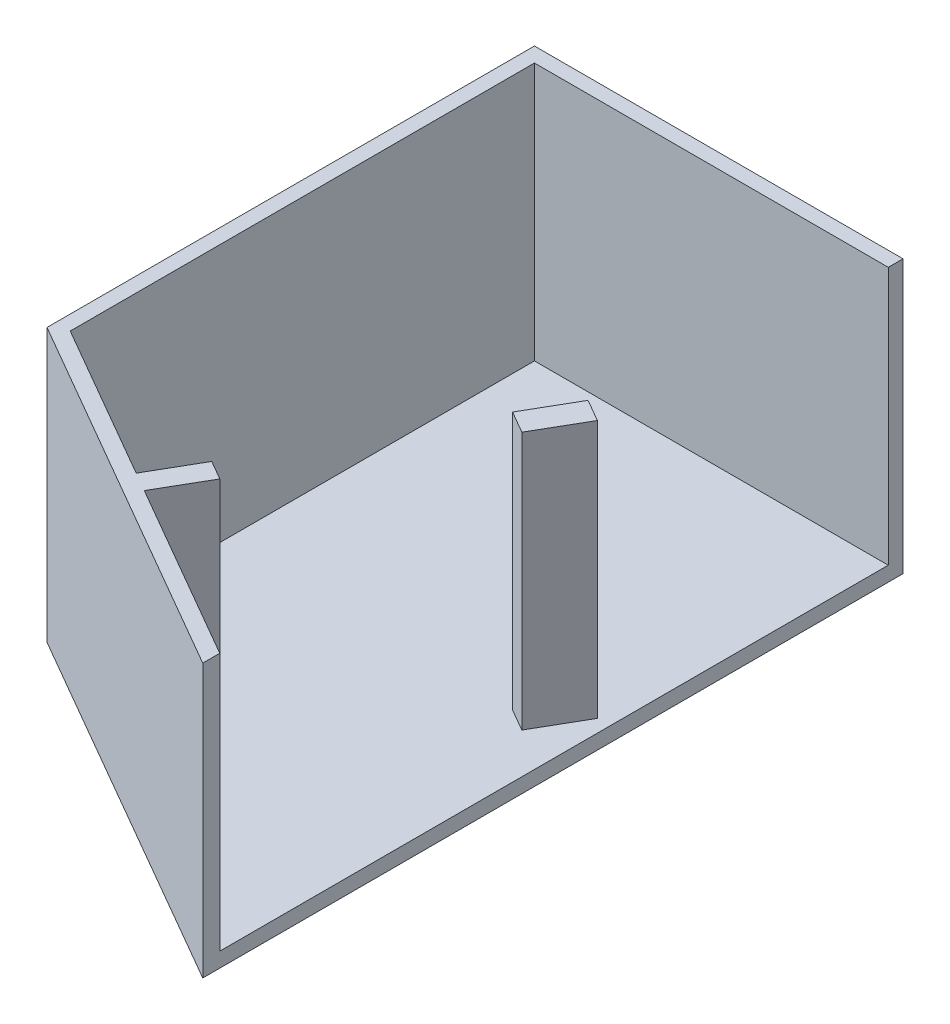
from build123d import *

# Parameters (mm, degrees)
EXTRUDE_1_DEPTH = 74
SHELL_1_T       = -4
EXTRUDE_2_DEPTH = 70


with BuildPart() as part:
    # 草图1 → 凸台-拉伸1 (new body)
    with BuildSketch(Plane(origin=(0, 0, 0), x_dir=(1, 0, 0), z_dir=(0, 1, 0))):
        Polygon((0, 0), (100, 0), (100, -190), (0, -132.264973081), align=None)
    extrude(amount=EXTRUDE_1_DEPTH)

    # 抽壳1
    shell_1_openings = [part.faces().sort_by_distance(p)[0] for p in [
        (52.985898342, 74, 81.428197876),
        (100, 37, 95),
    ]]
    offset(amount=SHELL_1_T, openings=shell_1_openings, kind=Kind.INTERSECTION)

    # 草图2 → 凸台-拉伸2 (add)
    with BuildSketch(Plane(origin=(0, 4, 0), x_dir=(1, 0, 0), z_dir=(0, 1, 0))):
        Polygon((96.535898385, -79.458149392), (89.035898385, -92.448530449), (83.035898385, -88.984428834), (90.535898385, -75.994047777), align=None)
        Polygon((51.535898385, -157.400435733), (59.035898385, -144.410054676), (53.839745962, -141.410054676), (46.339745962, -154.400435733), align=None)
    extrude(amount=EXTRUDE_2_DEPTH)


solid = part.part
